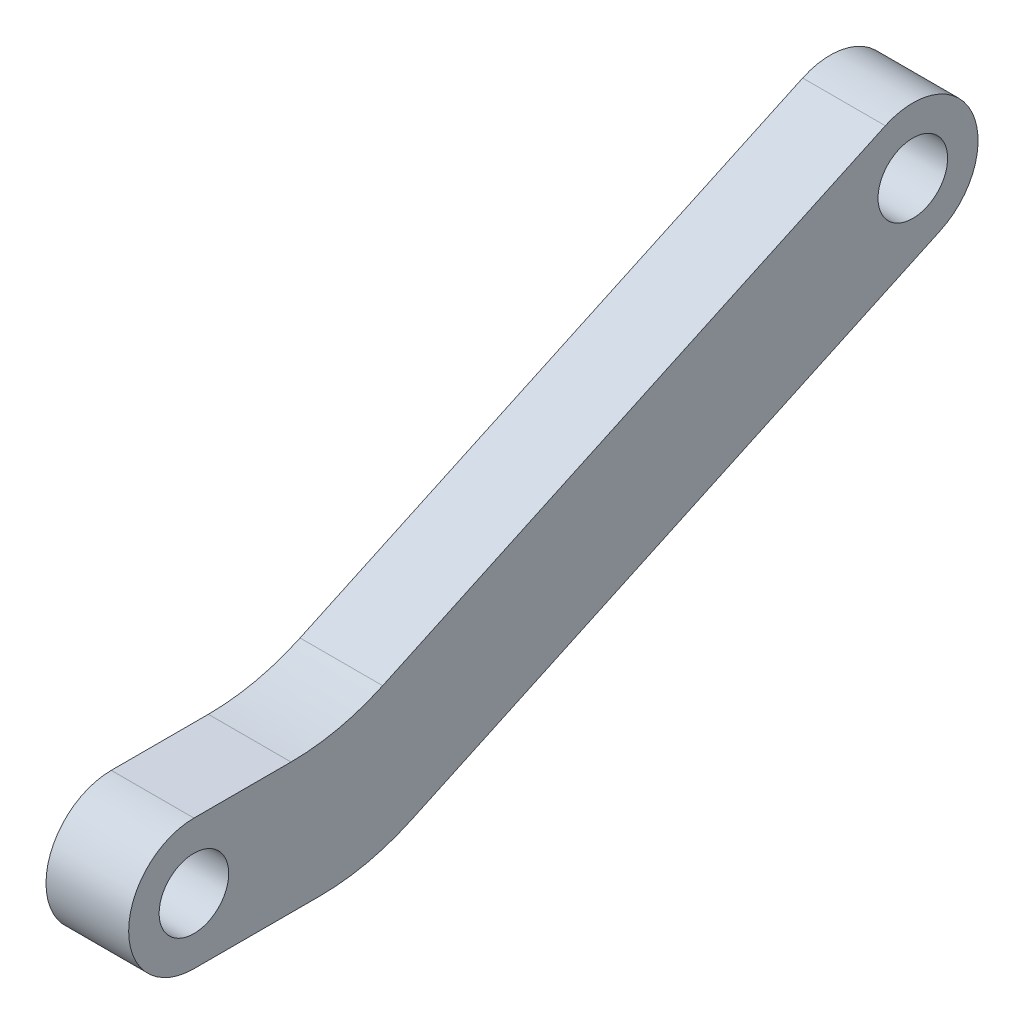
from build123d import *

# Parameters (mm, degrees)
SKETCH1_R           = 1.6
BOSS_EXTRUDE1_DEPTH = 1.9


with BuildPart() as part:
    # Sketch1 → Boss-Extrude1 (new, symmetric)
    with BuildSketch(Plane(origin=(0, 0, 0), x_dir=(0, 0, -1), z_dir=(1, 0, 0))):
        with BuildLine():
            Line((0, -3), (5.789792528, -3))
            ThreePointArc((5.789792528, -3), (7.947916139, -2.764348543), (10.004326756, -2.068500496))
            Line((10.004326756, -2.068500496), (34.314360268, 9.229449851))
            ThreePointArc((34.314360268, 9.229449851), (35.770550149, 13.214360268), (31.785639732, 14.670550149))
            Line((31.785639732, 14.670550149), (8.678202272, 3.931499504))
            ThreePointArc((8.678202272, 3.931499504), (6.621791656, 3.235651457), (4.463668044, 3))
            Line((4.463668044, 3), (0, 3))
            ThreePointArc((0, 3), (-3, 0), (0, -3))
        make_face()
        with Locations(Location((0, 0, 0), (0, 0, 180))):
            Circle(SKETCH1_R, mode=Mode.SUBTRACT)
        with Locations(Location((33.05, 11.95, 0), (0, 0, 180))):
            Circle(SKETCH1_R, mode=Mode.SUBTRACT)
    extrude(amount=BOSS_EXTRUDE1_DEPTH, both=True)


solid = part.part
